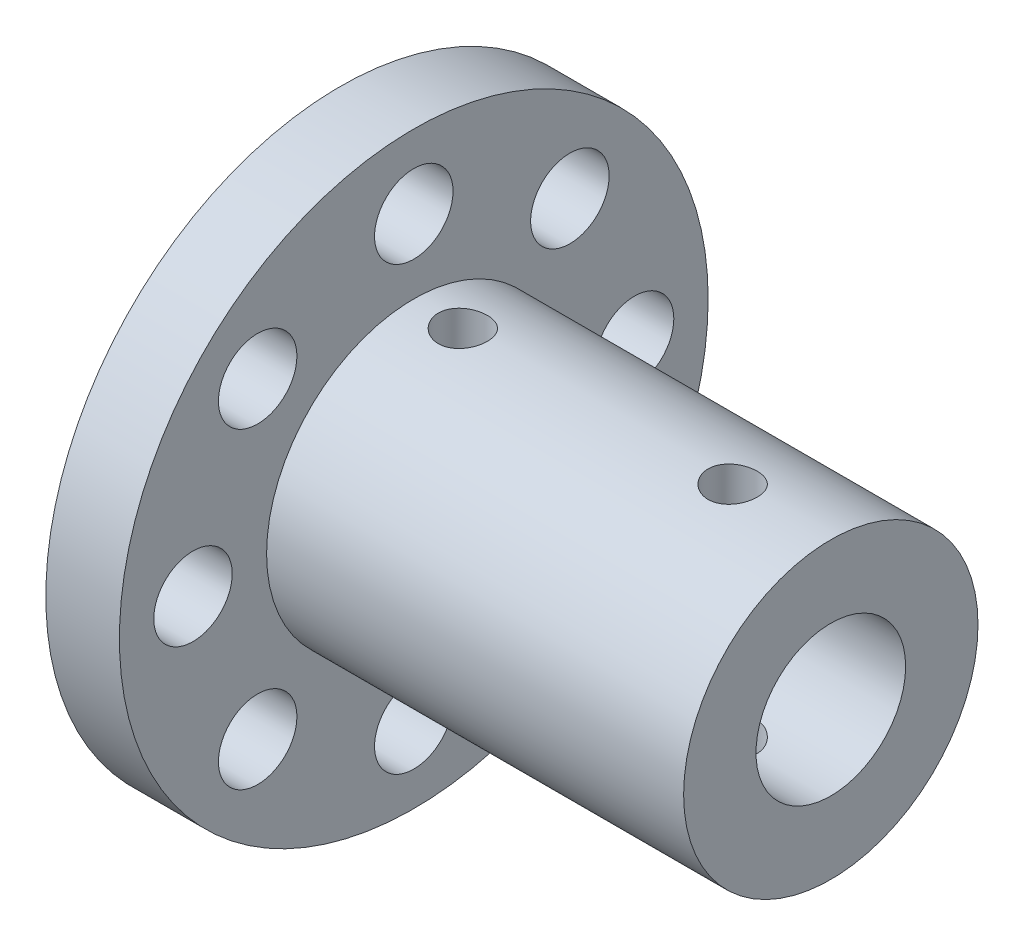
from build123d import *

# Parameters (mm, degrees)
COUPLING_BARREL_SKETCH_R         = 6
COUPLING_BARREL_DEPTH            = 20
SERVICE_LOCK_DISC_SKETCH_R       = 12
SERVICE_LOCK_DISC_DEPTH          = 3
SHAFT_RUNNING_BORE_SKETCH_R      = 3.05
SHAFT_RUNNING_BORE_DEPTH         = 20.2
TORQUE_CROSS_PIN_HOLE_1_SKETCH_R = 1
TORQUE_CROSS_PIN_HOLE_1_DEPTH    = 26
TORQUE_CROSS_PIN_HOLE_2_SKETCH_R = 1
TORQUE_CROSS_PIN_HOLE_2_DEPTH    = 26
SERVICE_LOCK_POSITION_1_SKETCH_R = 1.6
SERVICE_LOCK_POSITION_1_DEPTH    = 3.2
SERVICE_LOCK_POSITION_2_SKETCH_R = 1.6
SERVICE_LOCK_POSITION_2_DEPTH    = 3.2
SERVICE_LOCK_POSITION_3_SKETCH_R = 1.6
SERVICE_LOCK_POSITION_3_DEPTH    = 3.2
SERVICE_LOCK_POSITION_4_SKETCH_R = 1.6
SERVICE_LOCK_POSITION_4_DEPTH    = 3.2
SERVICE_LOCK_POSITION_5_SKETCH_R = 1.6
SERVICE_LOCK_POSITION_5_DEPTH    = 3.2
SERVICE_LOCK_POSITION_6_SKETCH_R = 1.6
SERVICE_LOCK_POSITION_6_DEPTH    = 3.2
SERVICE_LOCK_POSITION_7_SKETCH_R = 1.6
SERVICE_LOCK_POSITION_7_DEPTH    = 3.2
SERVICE_LOCK_POSITION_8_SKETCH_R = 1.6
SERVICE_LOCK_POSITION_8_DEPTH    = 3.2


with BuildPart() as part:
    # Coupling barrel sketch → Coupling barrel (new body)
    with BuildSketch(Plane(origin=(-7, 0, 0), x_dir=(0, 0, -1), z_dir=(1, 0, 0))):
        with Locations((19.5, -29)):
            Circle(COUPLING_BARREL_SKETCH_R)
    extrude(amount=COUPLING_BARREL_DEPTH)

    # Service lock disc sketch → Service lock disc (add)
    with BuildSketch(Plane(origin=(-7, 0, 0), x_dir=(0, 0, -1), z_dir=(1, 0, 0))):
        with Locations((19.5, -29)):
            Circle(SERVICE_LOCK_DISC_SKETCH_R)
    extrude(amount=SERVICE_LOCK_DISC_DEPTH)

    # Shaft running bore sketch → Shaft running bore (cut)
    with BuildSketch(Plane(origin=(-7.1, 0, 0), x_dir=(0, 0, -1), z_dir=(1, 0, 0))):
        with Locations((19.5, -29)):
            Circle(SHAFT_RUNNING_BORE_SKETCH_R)
    extrude(amount=SHAFT_RUNNING_BORE_DEPTH, mode=Mode.SUBTRACT)

    # Torque cross pin hole 1 sketch → Torque cross pin hole 1 (cut)
    with BuildSketch(Plane(origin=(0, -42, 0), x_dir=(1, 0, 0), z_dir=(0, 1, 0))):
        with Locations(Location((-2, 19.5, 0), (0, 0, 90))):
            Circle(TORQUE_CROSS_PIN_HOLE_1_SKETCH_R)
    extrude(amount=TORQUE_CROSS_PIN_HOLE_1_DEPTH, mode=Mode.SUBTRACT)

    # Torque cross pin hole 2 sketch → Torque cross pin hole 2 (cut)
    with BuildSketch(Plane(origin=(0, -42, 0), x_dir=(1, 0, 0), z_dir=(0, 1, 0))):
        with Locations(Location((9, 19.5, 0), (0, 0, 90))):
            Circle(TORQUE_CROSS_PIN_HOLE_2_SKETCH_R)
    extrude(amount=TORQUE_CROSS_PIN_HOLE_2_DEPTH, mode=Mode.SUBTRACT)

    # Service lock position 1 sketch → Service lock position 1 (cut)
    with BuildSketch(Plane(origin=(-7.1, 0, 0), x_dir=(0, 0, -1), z_dir=(1, 0, 0))):
        with Locations((19.5, -20)):
            Circle(SERVICE_LOCK_POSITION_1_SKETCH_R)
    extrude(amount=SERVICE_LOCK_POSITION_1_DEPTH, mode=Mode.SUBTRACT)

    # Service lock position 2 sketch → Service lock position 2 (cut)
    with BuildSketch(Plane(origin=(-7.1, 0, 0), x_dir=(0, 0, -1), z_dir=(1, 0, 0))):
        with Locations((13.136038969, -22.636038969)):
            Circle(SERVICE_LOCK_POSITION_2_SKETCH_R)
    extrude(amount=SERVICE_LOCK_POSITION_2_DEPTH, mode=Mode.SUBTRACT)

    # Service lock position 3 sketch → Service lock position 3 (cut)
    with BuildSketch(Plane(origin=(-7.1, 0, 0), x_dir=(0, 0, -1), z_dir=(1, 0, 0))):
        with Locations((10.5, -29)):
            Circle(SERVICE_LOCK_POSITION_3_SKETCH_R)
    extrude(amount=SERVICE_LOCK_POSITION_3_DEPTH, mode=Mode.SUBTRACT)

    # Service lock position 4 sketch → Service lock position 4 (cut)
    with BuildSketch(Plane(origin=(-7.1, 0, 0), x_dir=(0, 0, -1), z_dir=(1, 0, 0))):
        with Locations((13.136038969, -35.363961031)):
            Circle(SERVICE_LOCK_POSITION_4_SKETCH_R)
    extrude(amount=SERVICE_LOCK_POSITION_4_DEPTH, mode=Mode.SUBTRACT)

    # Service lock position 5 sketch → Service lock position 5 (cut)
    with BuildSketch(Plane(origin=(-7.1, 0, 0), x_dir=(0, 0, -1), z_dir=(1, 0, 0))):
        with Locations((19.5, -38)):
            Circle(SERVICE_LOCK_POSITION_5_SKETCH_R)
    extrude(amount=SERVICE_LOCK_POSITION_5_DEPTH, mode=Mode.SUBTRACT)

    # Service lock position 6 sketch → Service lock position 6 (cut)
    with BuildSketch(Plane(origin=(-7.1, 0, 0), x_dir=(0, 0, -1), z_dir=(1, 0, 0))):
        with Locations((25.863961031, -35.363961031)):
            Circle(SERVICE_LOCK_POSITION_6_SKETCH_R)
    extrude(amount=SERVICE_LOCK_POSITION_6_DEPTH, mode=Mode.SUBTRACT)

    # Service lock position 7 sketch → Service lock position 7 (cut)
    with BuildSketch(Plane(origin=(-7.1, 0, 0), x_dir=(0, 0, -1), z_dir=(1, 0, 0))):
        with Locations((28.5, -29)):
            Circle(SERVICE_LOCK_POSITION_7_SKETCH_R)
    extrude(amount=SERVICE_LOCK_POSITION_7_DEPTH, mode=Mode.SUBTRACT)

    # Service lock position 8 sketch → Service lock position 8 (cut)
    with BuildSketch(Plane(origin=(-7.1, 0, 0), x_dir=(0, 0, -1), z_dir=(1, 0, 0))):
        with Locations((25.863961031, -22.636038969)):
            Circle(SERVICE_LOCK_POSITION_8_SKETCH_R)
    extrude(amount=SERVICE_LOCK_POSITION_8_DEPTH, mode=Mode.SUBTRACT)


solid = part.part
